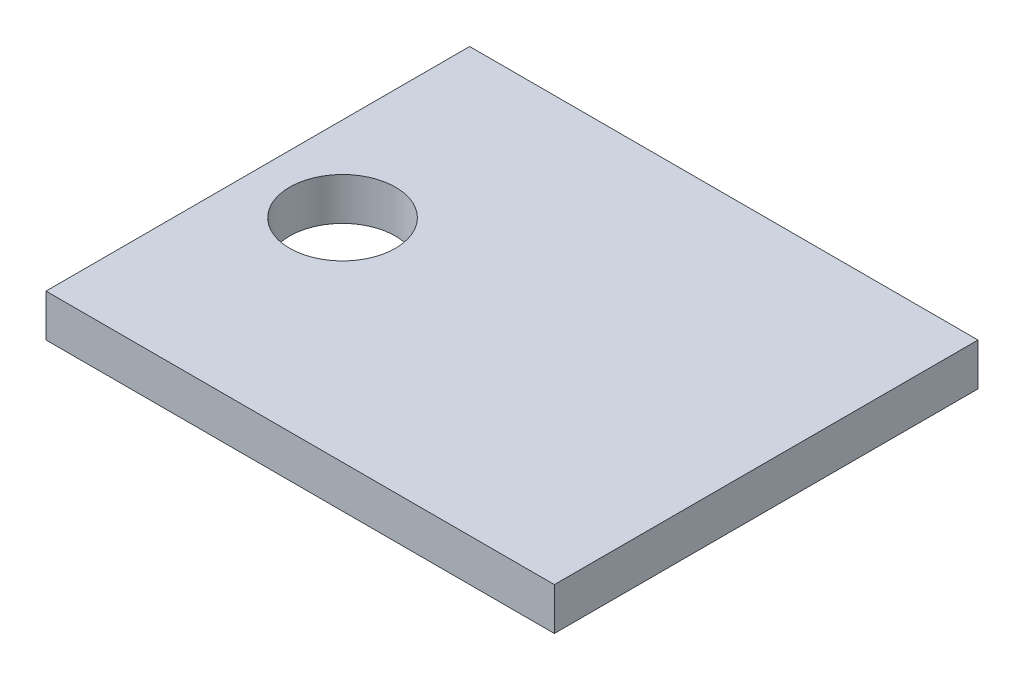
from build123d import *

# Parameters (mm, degrees)
SKETCH1_W           = 120
SKETCH1_H           = 100
SKETCH1_R           = 12.5
BOSS_EXTRUDE1_DEPTH = 5


with BuildPart() as part:
    # Sketch1 → Boss-Extrude1 (new, symmetric)
    with BuildSketch(Plane(origin=(0, 0, 0), x_dir=(1, 0, 0), z_dir=(0, 1, 0))):
        Rectangle(SKETCH1_W, SKETCH1_H)
        with Locations(Location((-40, 0, 0), (0, 0, 270))):
            Circle(SKETCH1_R, mode=Mode.SUBTRACT)
    extrude(amount=BOSS_EXTRUDE1_DEPTH, both=True)


solid = part.part
